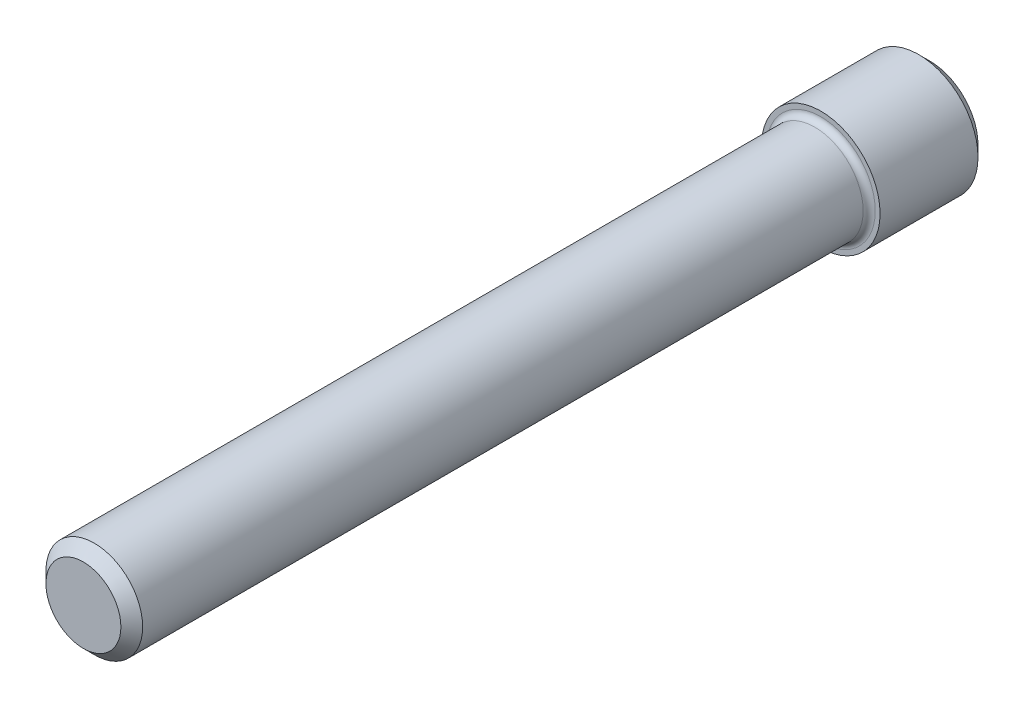
from build123d import *


with BuildPart() as part:
    # Sketch1 → Revolve1 (revolve)
    with BuildSketch(Plane(origin=(0, 0, 0), x_dir=(0, 0, -1), z_dir=(1, 0, 0)), mode=Mode.PRIVATE) as revolve1_sk:
        with BuildLine():
            Line((0, 0), (0, 3.1))
            Line((0, 3.1), (0.9, 4))
            Line((0.9, 4), (60.5, 4))
            ThreePointArc((60.5, 4), (60.853553391, 4.146446609), (61, 4.5))
            Line((61, 4.5), (61, 4.9))
            Line((61, 4.9), (69.1, 4.9))
            Line((69.1, 4.9), (70, 4))
            Line((70, 4), (70, 0))
            Line((70, 0), (0, 0))
        make_face()
    revolve(revolve1_sk.sketch.rotate(Axis((0, 0, 0), (0, 0, -1)), 90), axis=Axis((0, 0, 0), (0, 0, -1)))


solid = part.part
